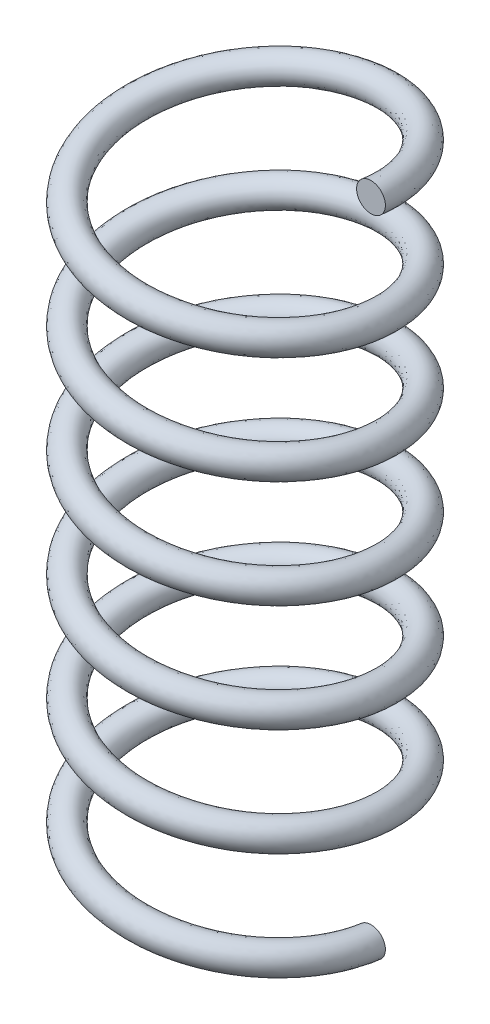
from build123d import *

# Parameters (mm, degrees)
SWEEP1_PITCH       = 2.237837708
SWEEP1_HEIGHT      = 13.427026249
SWEEP1_RADIUS      = 2.625
SWEEP1_START_ANGLE = 90
SKETCH4_R          = 0.3


with BuildPart() as part:
    # Sweep1: sweep along a helix
    with BuildLine() as sweep1_path:
        add(Helix(SWEEP1_PITCH, SWEEP1_HEIGHT, SWEEP1_RADIUS, center=(0, 0, 0), direction=(0, 1, 0), lefthand=True, mode=Mode.PRIVATE).rotate(Axis((0, 0, 0), (0, 1, 0)), SWEEP1_START_ANGLE))
    # Sketch4 → Sweep1 (sweep)
    with BuildSketch(Plane.XY):
        with Locations((2.625, 0)):
            Circle(SKETCH4_R)
    sweep(path=sweep1_path.line, is_frenet=True)


solid = part.part
